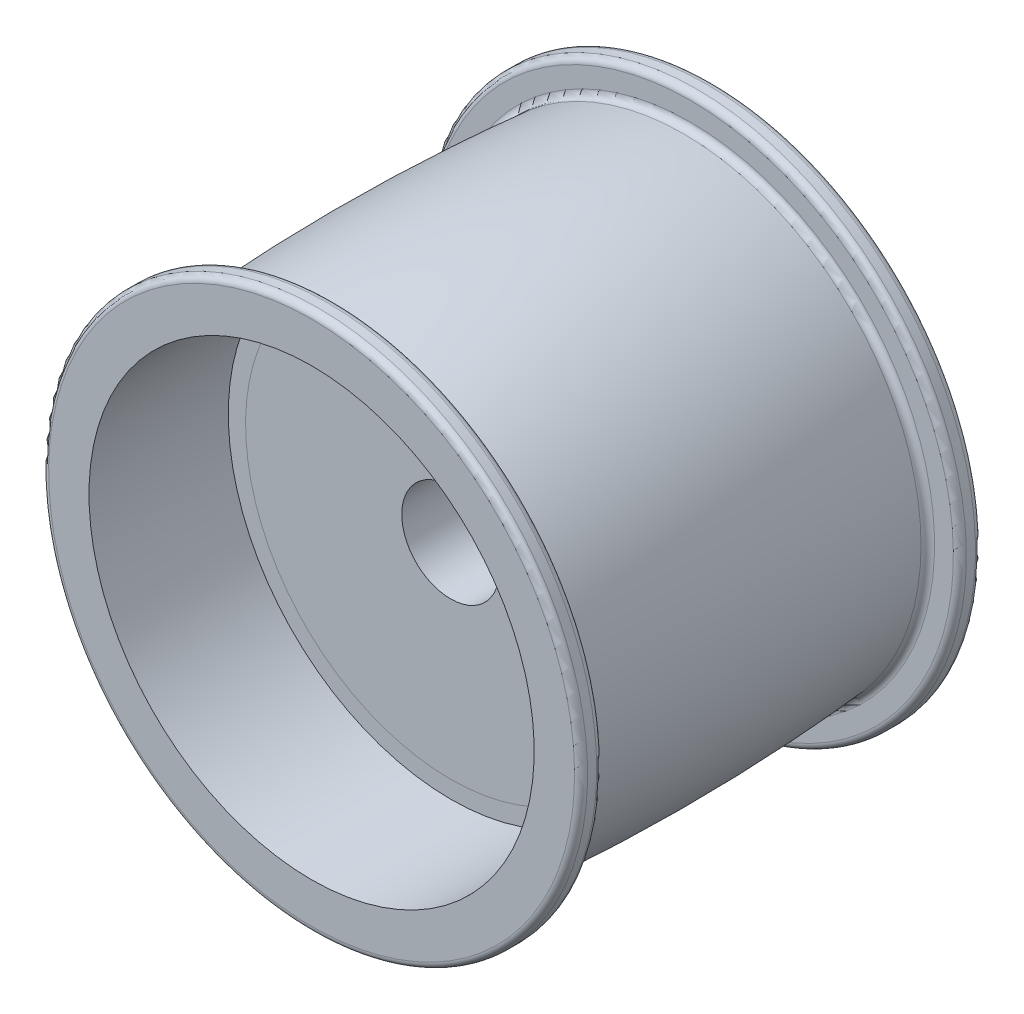
from build123d import *

# Parameters (mm, degrees)
FILLET1_R = 0.635
SKETCH2_W = 12
SKETCH2_H = 15.2375


with BuildPart() as part:
    # Sketch1 → Revolve1 (revolve)
    with BuildSketch(Plane(origin=(0, 0, 0), x_dir=(0, 0, -1), z_dir=(1, 0, 0)), mode=Mode.PRIVATE) as revolve1_sk:
        with BuildLine():
            Line((23.368, 26.289), (25.527, 26.289))
            Line((25.527, 26.289), (25.527, 21.717))
            Line((25.527, 21.717), (11.938, 21.717))
            Line((11.938, 21.717), (11.938, 20))
            Line((11.938, 20), (0, 20))
            Line((0, 20), (0, 21.717))
            Line((0, 21.717), (-13.589, 21.717))
            Line((-13.589, 21.717), (-13.589, 26.289))
            Line((-13.589, 26.289), (-11.43, 26.289))
            Line((-11.43, 26.289), (-11.43, 23.129734959))
            ThreePointArc((-11.43, 23.129734959), (5.969, 23.876), (23.368, 23.129734959))
            Line((23.368, 23.129734959), (23.368, 26.289))
        make_face()
    revolve(revolve1_sk.sketch.rotate(Axis((0, 0, 0), (0, 0, -1)), 180), axis=Axis((0, 0, 0), (0, 0, -1)))

    # Fillet1
    fillet1_edges = [part.edges().sort_by_distance(p)[0] for p in [
        (0, 26.289, 13.589),
        (0, 26.289, 11.43),
        (0, 23.129734959, 11.43),
        (0, 23.129734959, -23.368),
        (0, 26.289, -23.368),
        (0, 26.289, -25.527),
    ]]
    fillet(fillet1_edges, radius=FILLET1_R)


with BuildPart() as body_2:
    # Sketch2 → Revolve2 (revolve)
    with BuildSketch(Plane(origin=(0, 0, 0), x_dir=(0, 0, -1), z_dir=(1, 0, 0))):
        with Locations((5.969, 12.38125)):
            Rectangle(SKETCH2_W, SKETCH2_H)
    revolve(axis=Axis((0, 0, 0), (0, 0, -1)))


solid = Compound([part.part, body_2.part])
